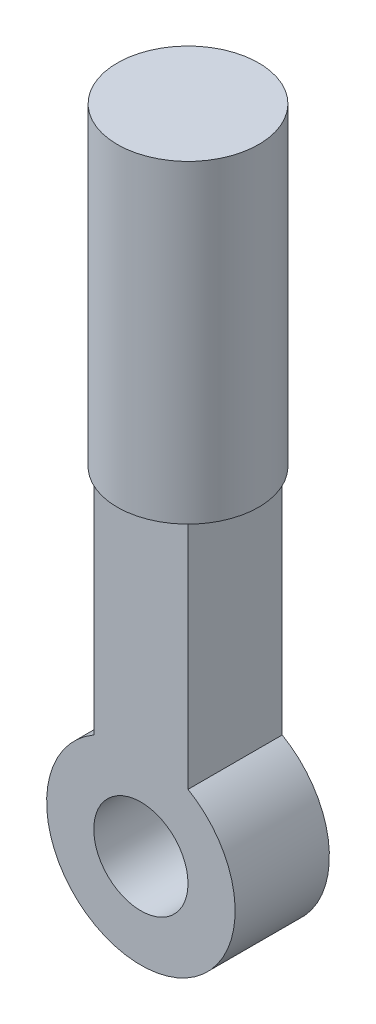
from build123d import *

# Parameters (mm, degrees)
CROQUIS1_R              = 1.5
SALIENTE_EXTRUIR1_DEPTH = 3
CROQUIS2_R              = 2.25
SALIENTE_EXTRUIR2_DEPTH = 10


with BuildPart() as part:
    # Croquis1 → Saliente-Extruir1 (new body)
    with BuildSketch(Plane.XY):
        with BuildLine():
            Line((1.5, 10), (-1.5, 10))
            Line((-1.5, 10), (-1.5, 2.598076211))
            ThreePointArc((-1.5, 2.598076211), (0, -3), (1.5, 2.598076211))
            Line((1.5, 2.598076211), (1.5, 10))
        make_face()
        Circle(CROQUIS1_R, mode=Mode.SUBTRACT)
    extrude(amount=SALIENTE_EXTRUIR1_DEPTH)

    # Croquis2 → Saliente-Extruir2 (add)
    with BuildSketch(Plane(origin=(0, 10, 0), x_dir=(1, 0, 0), z_dir=(0, 1, 0))):
        with Locations(Location((0, -1.5, 0), (0, 0, 270))):
            Circle(CROQUIS2_R)
    extrude(amount=SALIENTE_EXTRUIR2_DEPTH)


solid = part.part
